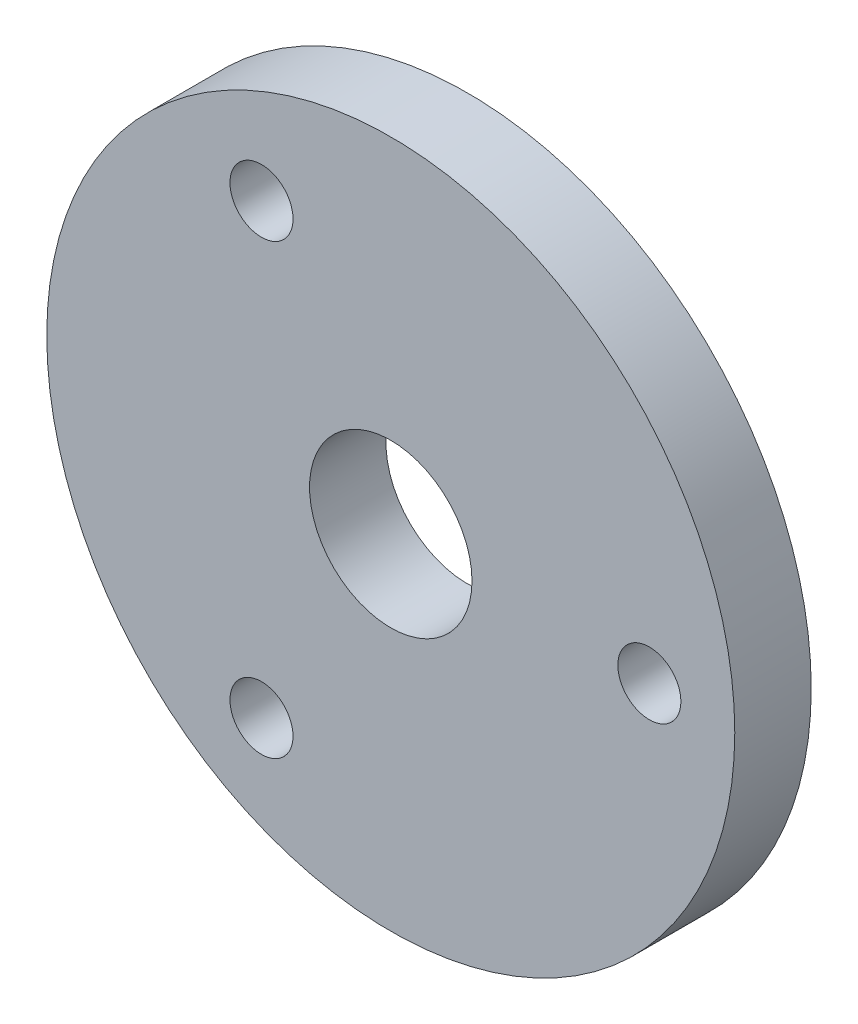
from build123d import *

# Parameters (mm, degrees)
SKETCH_1_R      = 18
SKETCH_1_R_2    = 4.25
SKETCH_1_R_3    = 1.65
EXTRUDE_1_DEPTH = 4


with BuildPart() as part:
    # 草图1 → 凸台-拉伸1 (new body)
    with BuildSketch(Plane.XY):
        with Locations((-0.736666667, 0.091402557)):
            Circle(SKETCH_1_R)
        with Locations((-0.736666667, 0.091402557)):
            Circle(SKETCH_1_R_2, mode=Mode.SUBTRACT)
        with Locations((12.793333333, 0.091402557)):
            Circle(SKETCH_1_R_3, mode=Mode.SUBTRACT)
        with Locations((-7.501666667, -11.625921157)):
            Circle(SKETCH_1_R_3, mode=Mode.SUBTRACT)
        with Locations((-7.501666667, 11.80872627)):
            Circle(SKETCH_1_R_3, mode=Mode.SUBTRACT)
    extrude(amount=EXTRUDE_1_DEPTH)


solid = part.part
